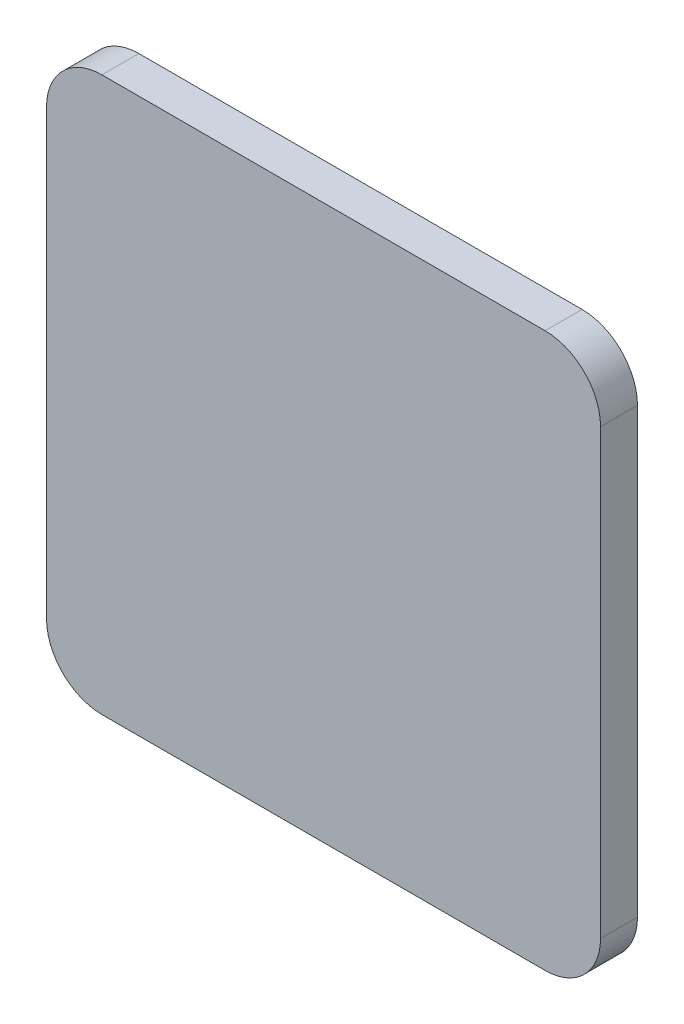
from build123d import *

# Parameters (mm, degrees)
IZIM1_W                     = 150
IZIM1_H                     = 150
Y_KSEKLIK_EKSTR_ZYON1_DEPTH = 10
RADYUS1_R                   = 15


with BuildPart() as part:
    # Çizim1 → Yükseklik-Ekstrüzyon1 (new body)
    with BuildSketch(Plane.XY):
        Rectangle(IZIM1_W, IZIM1_H)
    extrude(amount=Y_KSEKLIK_EKSTR_ZYON1_DEPTH)

    # Radyus1
    radyus1_edges = [part.edges().sort_by_distance(p)[0] for p in [
        (-75, 75, 5),
        (75, 75, 5),
        (75, -75, 5),
        (-75, -75, 5),
    ]]
    fillet(radyus1_edges, radius=RADYUS1_R)


solid = part.part
